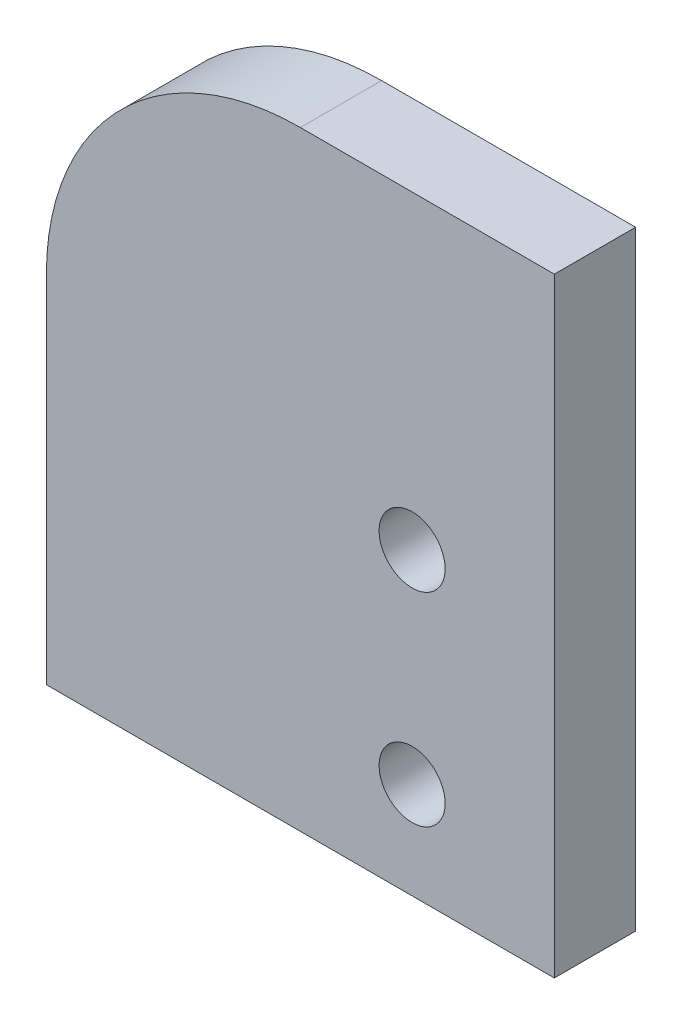
from build123d import *

# Parameters (mm, degrees)
BOSS_EXTRUDE1_DEPTH = 4
SKETCH2_R           = 1.625
CUT_EXTRUDE1_DEPTH  = 40.255572853


with BuildPart() as part:
    # Sketch1 → Boss-Extrude1 (new body)
    with BuildSketch(Plane.XY):
        with BuildLine():
            Line((0, 20), (0, 30))
            Line((0, 30), (-12.5, 30))
            ThreePointArc((-12.5, 30), (-21.338834765, 26.338834765), (-25, 17.5))
            Line((-25, 17.5), (-25, 0))
            Line((-25, 0), (0, 0))
            Line((0, 0), (0, 20))
        make_face()
    extrude(amount=BOSS_EXTRUDE1_DEPTH)

    # Sketch2 → Cut-Extrude1 (cut, through all)
    with BuildSketch(Plane.XY.offset(4)):
        with Locations((-7, 14.75)):
            Circle(SKETCH2_R)
        with Locations((-7, 4.75)):
            Circle(SKETCH2_R)
    extrude(amount=-CUT_EXTRUDE1_DEPTH, mode=Mode.SUBTRACT)


solid = part.part
